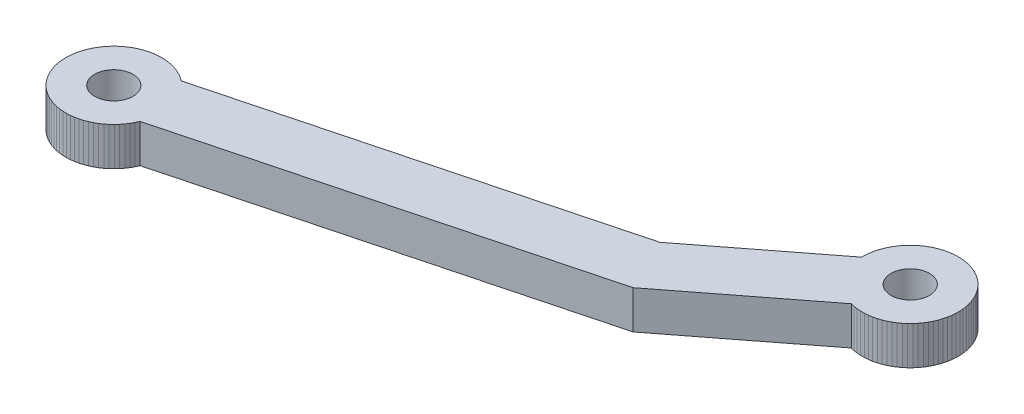
from build123d import *

# Parameters (mm, degrees)
SKETCH_1_R      = 0.999998023
SKETCH_1_R_2    = 1.000000976
EXTRUDE_1_DEPTH = 2.000000328


with BuildPart() as part:
    # Эскиз1 → Бобышка-Вытянуть1 (new body)
    with BuildSketch(Plane.XZ.offset(23.000000045)):
        Polygon((-84.028117359, -2.202427713), (-83.852753043, -2.287971787), (-83.6712569, -2.35957955), (-83.484724164, -2.416815143), (-83.294294775, -2.45932932), (-83.101138473, -2.486863639), (-82.906417549, -2.499250229), (-82.711324096, -2.496413421), (-82.517042756, -2.478370909), (-82.324765623, -2.445232356), (-82.135654986, -2.397199627), (-81.950873137, -2.334565157), (-81.771530211, -2.257710788), (-81.598728895, -2.167104278), (-81.433527172, -2.063297899), (-81.276915967, -1.946923556), (-81.129856408, -1.818690565), (-80.993250012, -1.679379493), (-80.867916346, -1.529839239), (-80.754637718, -1.370980637), (-80.654084682, -1.203771099), (-80.566875637, -1.029229374), (-80.493554473, -0.848418393), (-80.434553325, -0.662439677), (-80.390237272, -0.472426036), (-80.360867083, -0.279534725), (-80.346636474, -0.084940737), (-80.347619951, 0.110170622), (-80.363817513, 0.304610934), (-80.395124853, 0.497195811), (-80.441370606, 0.686752202), (-80.50224185, 0.872125558), (-80.577395856, 1.052186592), (-80.666355789, 1.225838787), (-80.768592656, 1.392024336), (-80.883473158, 1.549730659), (-81.010304391, 1.697997563), (-81.148318946, 1.835921779), (-81.296652555, 1.96266314), (-81.454440951, 2.077449812), (-81.620678306, 2.17958237), (-81.794388592, 2.268439159), (-81.974491477, 2.343478147), (-82.159906626, 2.40424322), (-82.349486649, 2.450363711), (-82.542091608, 2.481558593), (-82.736544311, 2.49763811), (-82.931652665, 2.49850424), (-83.126246929, 2.484151861), (-83.319112659, 2.454668051), (-83.509102464, 2.410232788), (-89.923687279, 7.373288274), (-110.284693539, 12.718074955), (-110.365286469, 12.895765714), (-110.459499061, 13.066628017), (-110.566742718, 13.229624368), (-110.68636924, 13.383760117), (-110.817655921, 13.528098352), (-110.959798098, 13.66175618), (-111.111931503, 13.78392335), (-111.273132265, 13.893852942), (-111.442416906, 13.990878128), (-111.618742347, 14.074404724), (-111.801050603, 14.143927023), (-111.98823154, 14.199018478), (-112.179122865, 14.239346609), (-112.372592092, 14.264663681), (-112.567447126, 14.274815097), (-112.762488425, 14.269742183), (-112.956546247, 14.249472879), (-113.1484285, 14.214130118), (-113.336972892, 14.163931832), (-113.521032035, 14.099182561), (-113.699480891, 14.020276256), (-113.871231675, 13.927693479), (-114.035241306, 13.821999542), (-114.190496504, 13.703836128), (-114.336073399, 13.573925011), (-114.471077919, 13.433056884), (-114.594690502, 13.282089494), (-114.706136286, 13.121941127), (-114.804767072, 12.95358967), (-114.889964461, 12.778058648), (-114.961214364, 12.596419081), (-115.018077195, 12.409775518), (-115.060210228, 12.219266966), (-115.087367594, 12.026051059), (-115.099363029, 11.831306852), (-115.096144378, 11.636218987), (-115.077711642, 11.441977695), (-115.04419893, 11.249764822), (-114.995785058, 11.060751043), (-114.932790399, 10.876088403), (-114.855580032, 10.696900077), (-114.764630795, 10.524280369), (-114.66050148, 10.35927888), (-114.543817937, 10.202899575), (-114.415287971, 10.05609706), (-114.275708795, 9.919765405), (-114.125922322, 9.794733487), (-113.966837525, 9.681764059), (-113.79943043, 9.581544437), (-113.624714315, 9.494686499), (-113.443754613, 9.421717376), (-113.257668912, 9.363083169), (-113.067567348, 9.319140576), (-112.874612212, 9.290155955), (-112.679995596, 9.276308119), (-112.484887242, 9.277679026), (-112.290471792, 9.294263087), (-112.09795624, 9.325955994), (-111.908487976, 9.372567758), (-111.72323674, 9.433813393), (-111.54332757, 9.50931944), (-111.369848251, 9.598624893), (-111.203864217, 9.701187722), (-111.046388745, 9.816383012), (-91.276302934, 4.62671183), (-85.344910622, 0.037510123), (-85.340216756, -0.157547402), (-85.320338607, -0.351645285), (-85.285380483, -0.543601287), (-85.235551, -0.732246088), (-85.171163082, -0.916430785), (-85.092611611, -1.095033367), (-85.000365973, -1.266965992), (-84.894999862, -1.431181328), (-84.777146578, -1.586679369), (-84.647521377, -1.73251261), (-84.50692147, -1.867792918), (-84.356203675, -1.991696423), (-84.196276963, -2.10346817), align=None)
        with Locations(Location((-82.845189618, -1.945e-06, 0), (0, 0, 270))):
            Circle(SKETCH_1_R, mode=Mode.SUBTRACT)
        with Locations(Location((-112.600002971, 11.775028493, 0), (0, 0, 270))):
            Circle(SKETCH_1_R_2, mode=Mode.SUBTRACT)
    extrude(amount=-EXTRUDE_1_DEPTH)


solid = part.part
